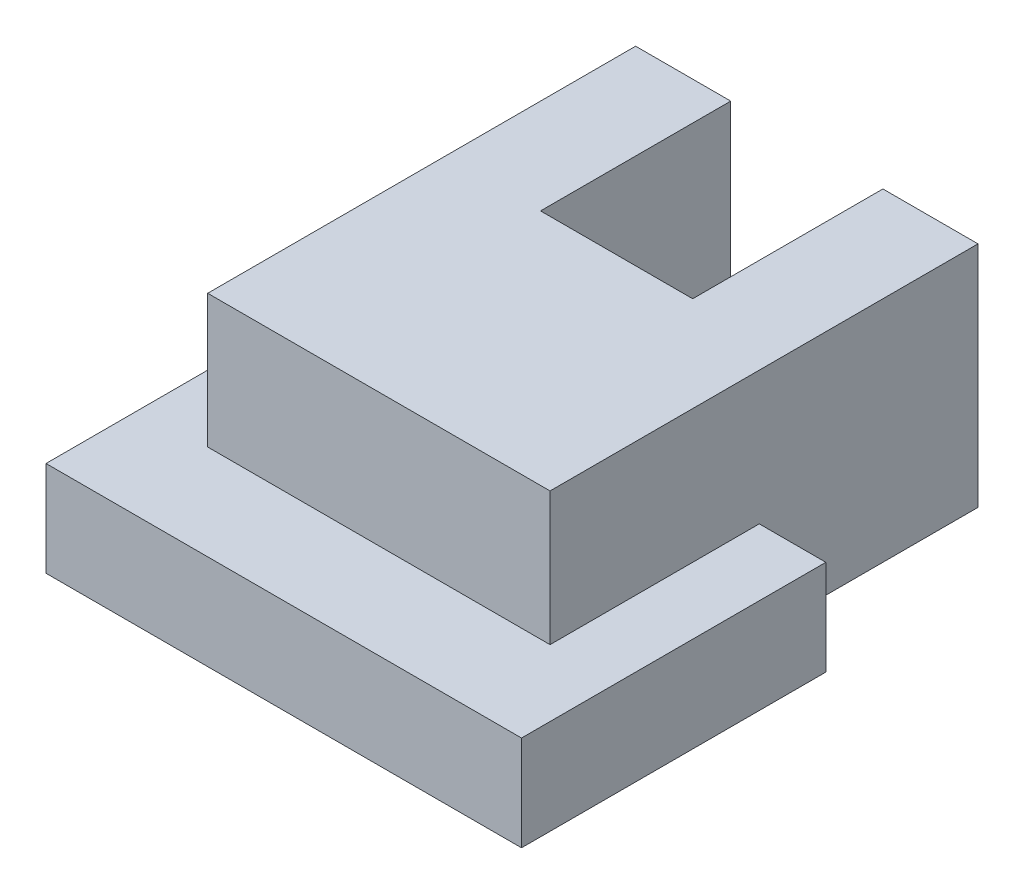
from build123d import *

# Parameters (mm, degrees)
CROQUIS2_W                   = 50
CROQUIS2_H                   = 32
SALIENTE_EXTRUIR1_DEPTH      = 10
SALIENTE_EXTRUIR2_DEPTH      = 14
SALIENTE_EXTRUIR2_DEPTH_BACK = 10


with BuildPart() as part:
    # Croquis2 → Saliente-Extruir1 (new body)
    with BuildSketch(Plane(origin=(0, 0, 0), x_dir=(1, 0, 0), z_dir=(0, 1, 0))):
        Rectangle(CROQUIS2_W, CROQUIS2_H)
    extrude(amount=SALIENTE_EXTRUIR1_DEPTH)

    # Croquis3 → Saliente-Extruir2 (add, two sides: drawn at the far end of the back side and taken through both)
    with BuildSketch(Plane(origin=(0, 10, 0), x_dir=(1, 0, 0), z_dir=(0, 1, 0)).offset(-SALIENTE_EXTRUIR2_DEPTH_BACK)):
        Polygon((8, 39), (18, 39), (18, -6), (-18, -6), (-18, 39), (-8, 39), (-8, 19), (8, 19), align=None)
    extrude(amount=SALIENTE_EXTRUIR2_DEPTH + SALIENTE_EXTRUIR2_DEPTH_BACK)


solid = part.part
